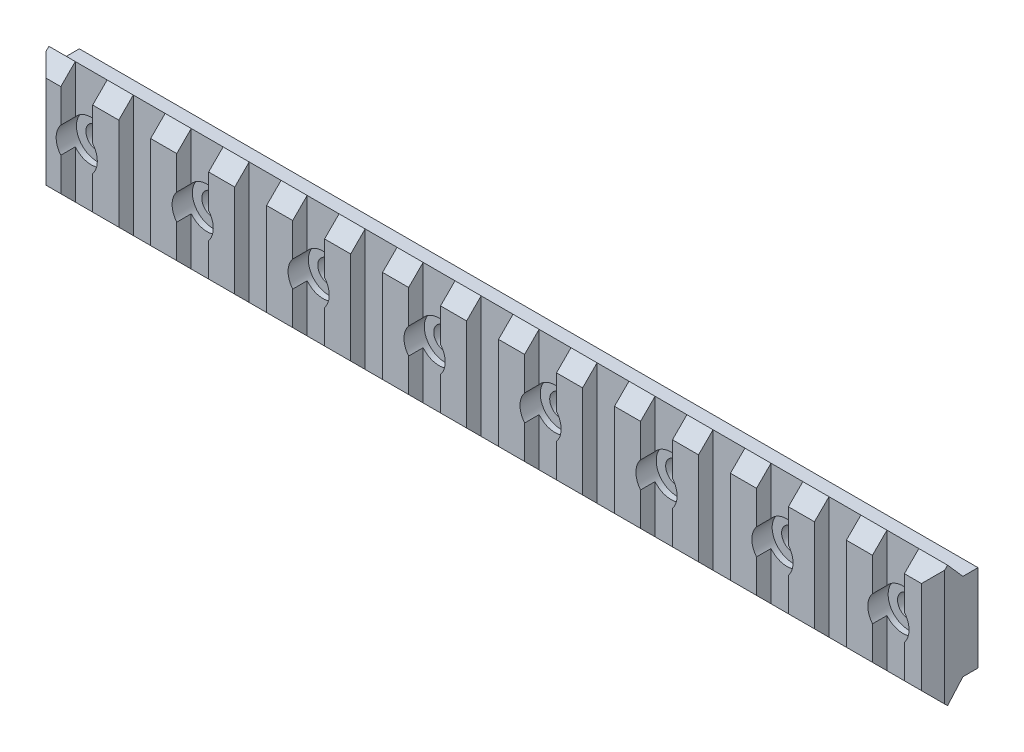
from build123d import *

# Parameters (mm, degrees)
EXTRUDE_2_DEPTH        = 155
CHAMFER_1_SIZE         = 2
SKETCH_5_W             = 5.5
SKETCH_5_H             = 2.5
CUT_EXTRUDE_1_DEPTH    = 156.548424936
CUT_EXTRUDE_2_REACH    = 157.444
SKETCH_6_R             = 1.925
SKETCH_7_R             = 3.55
CUT_EXTRUDE_3_DEPTH    = 3.5
PATTERN_LINEAR_1_COUNT = 15
PATTERN_LINEAR_1_PITCH = 10
PATTERN_LINEAR_2_COUNT = 8
PATTERN_LINEAR_2_PITCH = 20


with BuildPart() as part:
    # 스케치4 → 보스-돌출2 (new body)
    with BuildSketch(Plane(origin=(0, 0, 0), x_dir=(0, 0, -1), z_dir=(1, 0, 0))):
        Polygon((0, 7.5), (0, -7.5), (-2.6, -7.5), (-5.25, -10.5), (-7.75, -8), (-7.75, 8), (-5.25, 10.5), (-2.6, 7.5), align=None)
    extrude(amount=EXTRUDE_2_DEPTH)

    # 모따기1
    chamfer_1_edges = [part.edges().sort_by_distance(p)[0] for p in [
        (0, 0, 7.75),
        (155, 0, 7.75),
    ]]
    chamfer(chamfer_1_edges, length=CHAMFER_1_SIZE)

    # 스케치5 → 컷-돌출1 (cut, symmetric)
    with BuildSketch(Plane(origin=(0, 0, 0), x_dir=(1, 0, 0), z_dir=(0, 1, 0))):
        with Locations((7.3, -6.5)):
            Rectangle(SKETCH_5_W, SKETCH_5_H)
    cut_extrude_1 = extrude(amount=CUT_EXTRUDE_1_DEPTH, both=True, mode=Mode.SUBTRACT)

    # 스케치6 → 컷-돌출2 (cut, up to next)
    with BuildSketch(Plane.XY.offset(5.25), mode=Mode.PRIVATE) as cut_extrude_2_sk1:
        with Locations((7.3, 0)):
            Circle(SKETCH_6_R)
    cut_extrude_2_tool1 = extrude(cut_extrude_2_sk1.sketch, amount=-CUT_EXTRUDE_2_REACH, mode=Mode.PRIVATE) & part.part
    cut_extrude_2 = cut_extrude_2_tool1.solids().sort_by_distance((7.3, 0, 5.25))[0]
    add(cut_extrude_2, mode=Mode.SUBTRACT)

    # 스케치7 → 컷-돌출3 (cut)
    with BuildSketch(Plane.XY.offset(7.75)):
        with Locations((7.3, 0)):
            Circle(SKETCH_7_R)
    cut_extrude_3 = extrude(amount=-CUT_EXTRUDE_3_DEPTH, mode=Mode.SUBTRACT)

    # 선형 패턴1: 컷-돌출1 ×15
    with Locations(*[(i * PATTERN_LINEAR_1_PITCH, 0, 0) for i in range(1, PATTERN_LINEAR_1_COUNT)]):
        add(cut_extrude_1, mode=Mode.SUBTRACT)

    # 선형 패턴2: 컷-돌출2, 컷-돌출3 ×8
    with Locations(*[(i * PATTERN_LINEAR_2_PITCH, 0, 0) for i in range(1, PATTERN_LINEAR_2_COUNT)]):
        add(cut_extrude_2, mode=Mode.SUBTRACT)
        add(cut_extrude_3, mode=Mode.SUBTRACT)


solid = part.part
